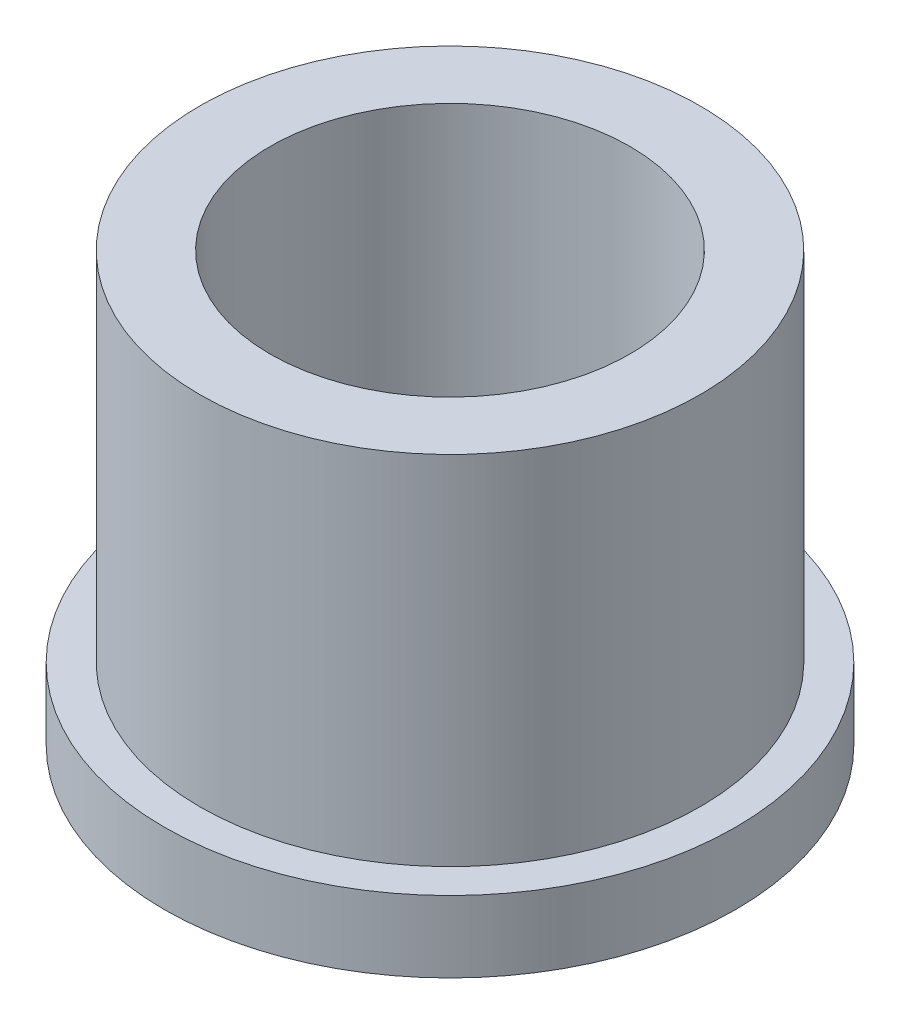
from build123d import *

# Parameters (mm, degrees)
BOSS_EXTRUDE1_DEPTH      = 9.525
BOSS_EXTRUDE1_DEPTH_BACK = 9.525
SKETCH3_R                = 11.1252
SKETCH3_R_2              = 8.001
BOSS_EXTRUDE2_START      = -9.525
SKETCH6_R                = 12.7
SKETCH6_R_2              = 11.1252
BOSS_EXTRUDE2_DEPTH      = 3.175


with BuildPart() as part:
    # Sketch3 → Boss-Extrude1 (new, two sides: drawn at the far end of the back side and taken through both)
    with BuildSketch(Plane(origin=(0, 0, 0), x_dir=(1, 0, 0), z_dir=(0, 1, 0)).offset(-BOSS_EXTRUDE1_DEPTH_BACK)):
        with Locations(Location((0, 0, 0), (0, 0, 270))):
            Circle(SKETCH3_R)
        with Locations(Location((0, 0, 0), (0, 0, 270))):
            Circle(SKETCH3_R_2, mode=Mode.SUBTRACT)
    extrude(amount=BOSS_EXTRUDE1_DEPTH + BOSS_EXTRUDE1_DEPTH_BACK)

    # Sketch6 → Boss-Extrude2 (add)
    with BuildSketch(Plane(origin=(0, 0, 0), x_dir=(1, 0, 0), z_dir=(0, 1, 0)).offset(BOSS_EXTRUDE2_START)):
        with Locations(Location((0, 0, 0), (0, 0, 270))):
            Circle(SKETCH6_R)
        with Locations(Location((0, 0, 0), (0, 0, 270))):
            Circle(SKETCH6_R_2, mode=Mode.SUBTRACT)
    extrude(amount=BOSS_EXTRUDE2_DEPTH)


solid = part.part
